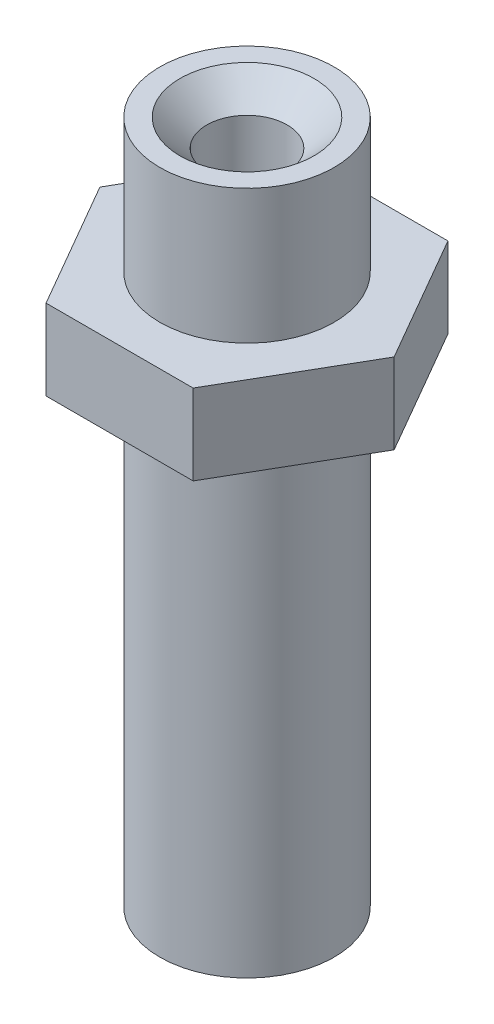
from build123d import *

# Parameters (mm, degrees)
SZKIC1_R                         = 6.5
DODANIE_WYCI_GNI_CIE1_DEPTH      = 6
SZKIC1_3_R                       = 6.5
SZKIC1_3_R_2                     = 3
DODANIE_WYCI_GNI_CIE2_DEPTH      = 16
DODANIE_WYCI_GNI_CIE3_DEPTH      = 16
DODANIE_WYCI_GNI_CIE3_DEPTH_BACK = 35
SZKIC1_4_R                       = 6.5
SZKIC1_4_R_2                     = 3
SFAZOWANIE1_SIZE                 = 2
SFAZOWANIE2_SIZE                 = 2


with BuildPart() as part:
    # Szkic1 → Dodanie-wyciągnięcie1 (new body)
    with BuildSketch(Plane(origin=(0, 0, 0), x_dir=(1, 0, 0), z_dir=(0, 1, 0))):
        Polygon((-5.484827557, 9.5), (-10.969655115, 0), (-5.484827557, -9.5), (5.484827557, -9.5), (10.969655115, 0), (5.484827557, 9.5), align=None)
        Circle(SZKIC1_R, mode=Mode.SUBTRACT)
    extrude(amount=DODANIE_WYCI_GNI_CIE1_DEPTH)

    # Szkic1<3> → Dodanie-wyciągnięcie2 (add)
    with BuildSketch(Plane(origin=(0, 0, 0), x_dir=(1, 0, 0), z_dir=(0, 1, 0))):
        Circle(SZKIC1_3_R)
        Circle(SZKIC1_3_R_2, mode=Mode.SUBTRACT)
    extrude(amount=DODANIE_WYCI_GNI_CIE2_DEPTH)

    # Szkic1<4> → Dodanie-wyciągnięcie3 (add, two sides: drawn at the far end of the back side and taken through both)
    with BuildSketch(Plane(origin=(0, 0, 0), x_dir=(1, 0, 0), z_dir=(0, 1, 0)).offset(-DODANIE_WYCI_GNI_CIE3_DEPTH_BACK)):
        Circle(SZKIC1_4_R)
        Circle(SZKIC1_4_R_2, mode=Mode.SUBTRACT)
    extrude(amount=DODANIE_WYCI_GNI_CIE3_DEPTH + DODANIE_WYCI_GNI_CIE3_DEPTH_BACK)

    # Sfazowanie1
    sfazowanie1_edges = [part.edges().sort_by_distance(p)[0] for p in [
        (-3, 16, 0),
    ]]
    chamfer(sfazowanie1_edges, length=SFAZOWANIE1_SIZE)

    # Sfazowanie2
    sfazowanie2_edges = [part.edges().sort_by_distance(p)[0] for p in [
        (-3, -35, 0),
    ]]
    chamfer(sfazowanie2_edges, length=SFAZOWANIE2_SIZE)


solid = part.part
